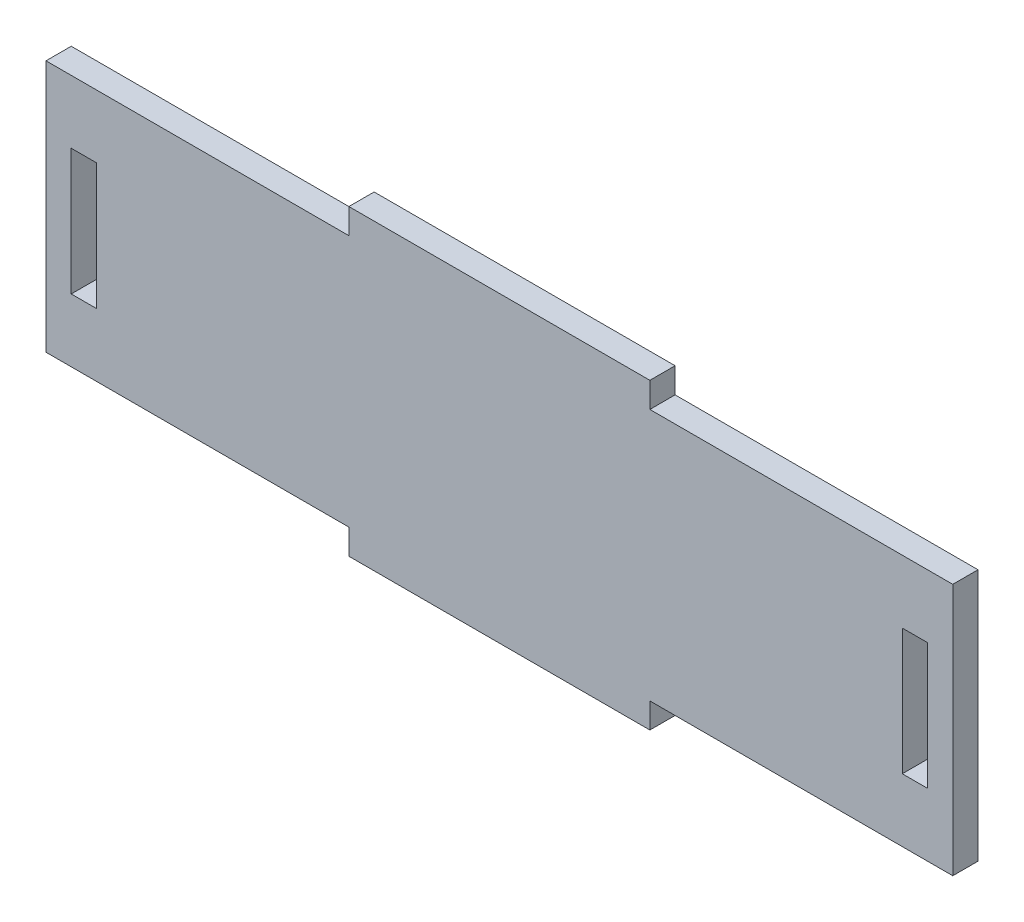
from build123d import *

# Parameters (mm, degrees)
SKETCH1_W           = 2
SKETCH1_H           = 10
BOSS_EXTRUDE1_DEPTH = 2


with BuildPart() as part:
    # Sketch1 → Boss-Extrude1 (new body)
    with BuildSketch(Plane.XY):
        Polygon((0, 0), (24, 0), (24, -2), (47.848, -2), (47.848, 0), (71.848, 0), (71.848, 20), (47.848, 20), (47.848, 22), (24, 22), (24, 20), (0, 20), align=None)
        with Locations((3, 10)):
            Rectangle(SKETCH1_W, SKETCH1_H, mode=Mode.SUBTRACT)
        with Locations((68.848, 10)):
            Rectangle(SKETCH1_W, SKETCH1_H, mode=Mode.SUBTRACT)
    extrude(amount=BOSS_EXTRUDE1_DEPTH)


solid = part.part
